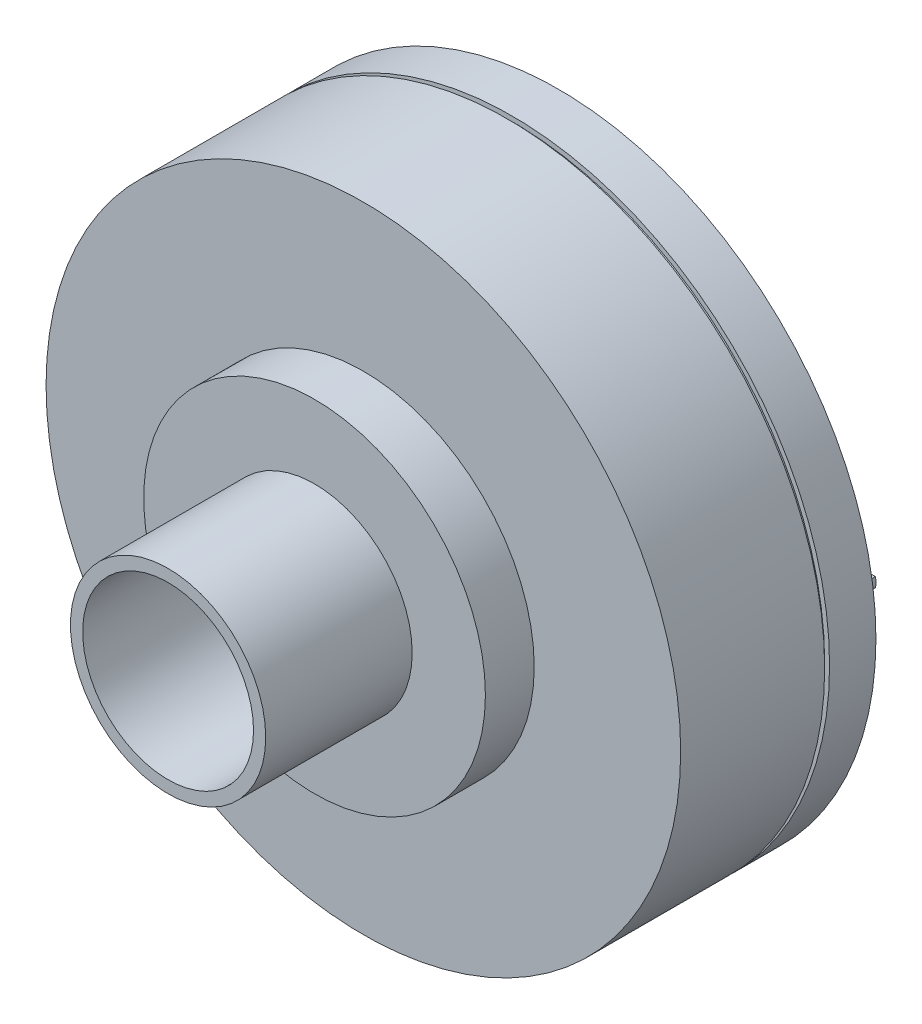
from build123d import *

# Parameters (mm, degrees)
CROQUIS3_R              = 0.5
CORTAR_EXTRUIR1_DEPTH   = 1
SALIENTE_EXTRUIR3_START = 5
SALIENTE_EXTRUIR3_DEPTH = 5


with BuildPart() as part:
    # Croquis2 → Revolución1 (revolve)
    with BuildSketch(Plane(origin=(0, 0, 0), x_dir=(0, 0, -1), z_dir=(1, 0, 0)), mode=Mode.PRIVATE) as revoluci_n1_sk:
        Polygon((0, 0), (0, 6.5), (-0.95, 6.5), (-0.95, 6.4), (-1.05, 6.4), (-1.05, 6.5), (-4, 6.5), (-4, 3.5), (-5, 3.5), (-5, 2), (-8, 2), (-8, 1.75), (-4, 1.75), (-4, 0), align=None)
    revolve(revoluci_n1_sk.sketch.rotate(Axis((0, 0, 4), (0, 0, -1)), 90), axis=Axis((0, 0, 4), (0, 0, -1)))

    # Croquis3 → Cortar-Extruir1 (cut)
    with BuildSketch(Plane(origin=(0, 0, 0), x_dir=(-1, 0, 0), z_dir=(0, 0, -1))):
        with Locations((-2, -3)):
            Circle(CROQUIS3_R)
        with Locations((2, -3)):
            Circle(CROQUIS3_R)
        with Locations((0, -2)):
            Circle(CROQUIS3_R)
    extrude(amount=-CORTAR_EXTRUIR1_DEPTH, mode=Mode.SUBTRACT)

    # Croquis5 → Saliente-Extruir3 (add)
    with BuildSketch(Plane(origin=(0, 0, 1), x_dir=(-1, 0, 0), z_dir=(0, 0, -1)).offset(SALIENTE_EXTRUIR3_START)):
        with BuildLine():
            Line((-0.489897949, -1.9), (0.489897949, -1.9))
            ThreePointArc((0.489897949, -1.9), (0.5, -2), (0.489897949, -2.1))
            Line((0.489897949, -2.1), (-0.489897949, -2.1))
            ThreePointArc((-0.489897949, -2.1), (-0.5, -2), (-0.489897949, -1.9))
        make_face()
        with BuildLine():
            Line((1.510102051, -2.9), (2.489897949, -2.9))
            ThreePointArc((2.489897949, -2.9), (2.5, -3), (2.489897949, -3.1))
            Line((2.489897949, -3.1), (1.510102051, -3.1))
            ThreePointArc((1.510102051, -3.1), (1.5, -3), (1.510102051, -2.9))
        make_face()
        with BuildLine():
            Line((-2.489897949, -2.9), (-1.510102051, -2.9))
            ThreePointArc((-1.510102051, -2.9), (-1.5, -3), (-1.510102051, -3.1))
            Line((-1.510102051, -3.1), (-2.489897949, -3.1))
            ThreePointArc((-2.489897949, -3.1), (-2.5, -3), (-2.489897949, -2.9))
        make_face()
    extrude(amount=-SALIENTE_EXTRUIR3_DEPTH)


solid = part.part
